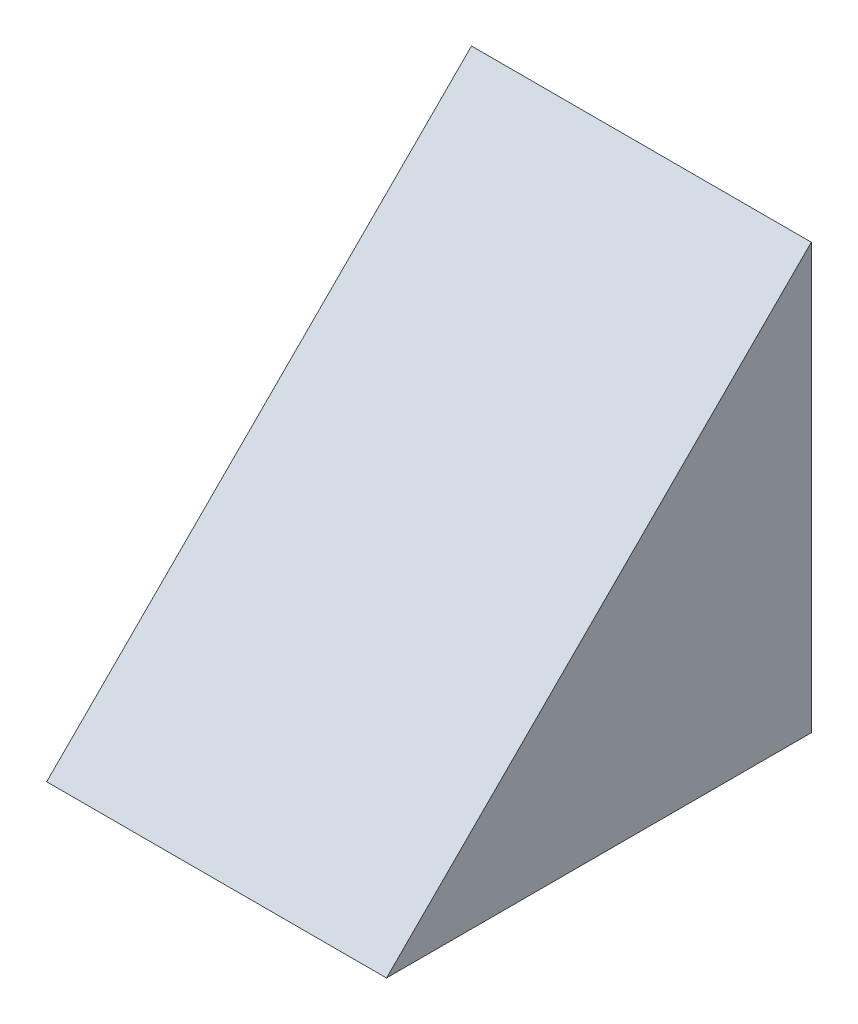
from build123d import *

# Parameters (mm, degrees)
BOSS_EXTRUDE1_DEPTH = 20
SKETCH3_R           = 2
CUT_EXTRUDE1_DEPTH  = 6
SKETCH4_R           = 2
CUT_EXTRUDE2_DEPTH  = 6


with BuildPart() as part:
    # Sketch2 → Boss-Extrude1 (new body)
    with BuildSketch(Plane(origin=(0, 0, 0), x_dir=(0, 0, -1), z_dir=(1, 0, 0))):
        Polygon((-12.5, 0), (12.5, 0), (12.5, 25), align=None)
    extrude(amount=BOSS_EXTRUDE1_DEPTH)

    # Sketch3 → Cut-Extrude1 (cut)
    with BuildSketch(Plane(origin=(0, 0, -12.5), x_dir=(-1, 0, 0), z_dir=(0, 0, -1))):
        with Locations((-10, 10)):
            Circle(SKETCH3_R)
    extrude(amount=-CUT_EXTRUDE1_DEPTH, mode=Mode.SUBTRACT)

    # Sketch4 → Cut-Extrude2 (cut)
    with BuildSketch(Plane.XZ):
        with Locations(Location((10, -2.5, 0), (0, 0, 270))):
            Circle(SKETCH4_R)
    extrude(amount=-CUT_EXTRUDE2_DEPTH, mode=Mode.SUBTRACT)


solid = part.part
